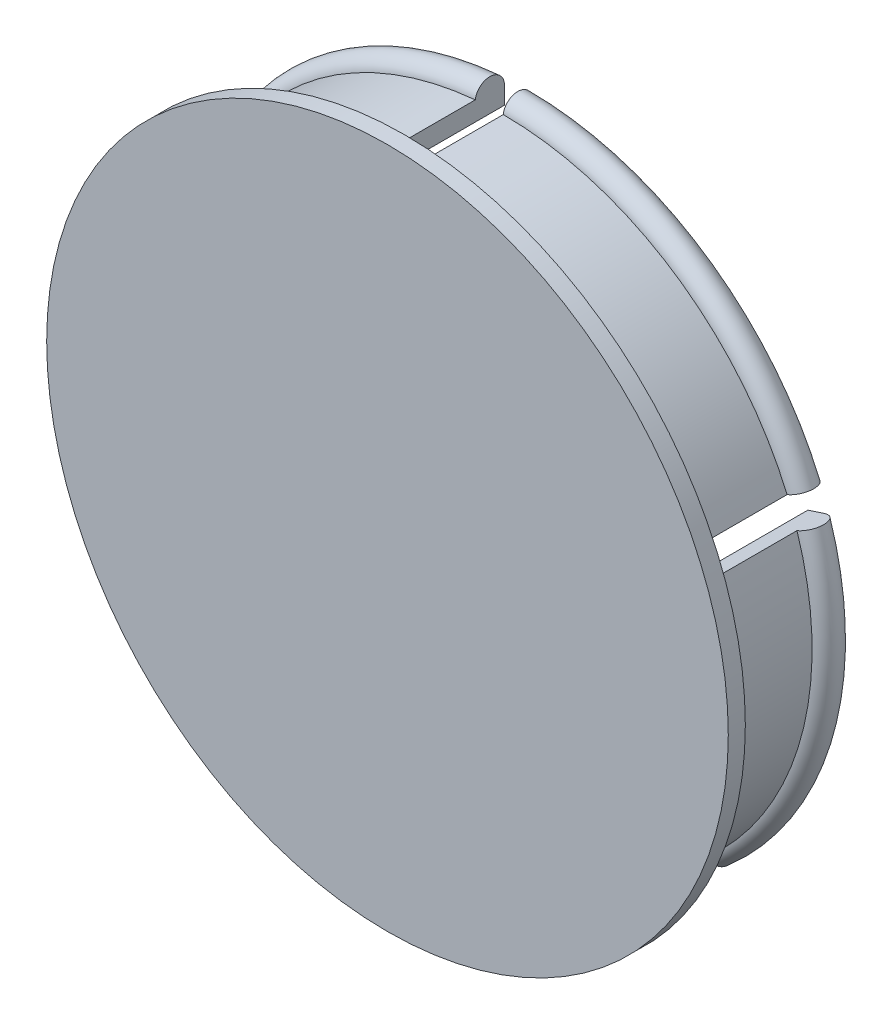
from build123d import *

# Parameters (mm, degrees)
ESQUISSE1_R                  = 40
BOSS_EXTRU_1_DEPTH           = 2
ESQUISSE2_R                  = 36.25
ESQUISSE2_R_2                = 34
BOSS_EXTRU_2_DEPTH           = 15
ENL_V_MAT_EXTRU_4_DEPTH      = 25
R_P_TITION_CIRCULAIRE1_COUNT = 5


with BuildPart() as part:
    # Esquisse1 → Boss.-Extru.1 (new body)
    with BuildSketch(Plane.XY):
        Circle(ESQUISSE1_R)
    boss_extru_1 = extrude(amount=BOSS_EXTRU_1_DEPTH)

    # Esquisse2 → Boss.-Extru.2 (add)
    with BuildSketch(Plane(origin=(0, 0, 0), x_dir=(-1, 0, 0), z_dir=(0, 0, -1))):
        with Locations(Location((0, 0, 0), (0, 0, 180))):
            Circle(ESQUISSE2_R)
        Circle(ESQUISSE2_R_2, mode=Mode.SUBTRACT)
    extrude(amount=BOSS_EXTRU_2_DEPTH)

    # Balayage1: sweep along a curve in space
    with BuildLine() as balayage1_path:
        ThreePointArc((-36.25, 0, -15), (-25.632620818, 25.632620818, -15), (0, 36.25, -15))
        ThreePointArc((0, 36.25, -15), (25.632620818, 25.632620818, -15), (36.25, 0, -15))
        ThreePointArc((36.25, 0, -15), (25.632620818, -25.632620818, -15), (0, -36.25, -15))
        ThreePointArc((0, -36.25, -15), (-25.632620818, -25.632620818, -15), (-36.25, 0, -15))
    # Esquisse3 → Balayage1 (sweep)
    with BuildSketch(Plane(origin=(0, 0, 0), x_dir=(0, 0, -1), z_dir=(1, 0, 0))):
        with BuildLine():
            Line((15, -36.25), (11.586582868, -36.25))
            ThreePointArc((11.586582868, -36.25), (13.293291434, -37.75), (15, -36.25))
        make_face()
    sweep(path=balayage1_path.line)

    # Esquisse6 → Enlèv. mat.-Extru.4 (cut)
    with BuildSketch(Plane(origin=(0, 0, 0), x_dir=(-1, 0, 0), z_dir=(0, 0, -1))):
        Polygon((0, 34), (0, 93.818938969), (3.286152277, 93.649691617), (3.286152277, 33.840821551), align=None)
    enl_v_mat_extru_4 = extrude(amount=ENL_V_MAT_EXTRU_4_DEPTH, mode=Mode.SUBTRACT)

    # Répétition circulaire1: Boss.-Extru.1, Enlèv. mat.-Extru.4 ×5 about axis
    r_p_tition_circulaire1_axis = Axis((0, 0, 0), (0, 0, 1))
    add([boss_extru_1.rotate(r_p_tition_circulaire1_axis, i * 360 / R_P_TITION_CIRCULAIRE1_COUNT) for i in range(1, R_P_TITION_CIRCULAIRE1_COUNT)])
    add([enl_v_mat_extru_4.rotate(r_p_tition_circulaire1_axis, i * 360 / R_P_TITION_CIRCULAIRE1_COUNT) for i in range(1, R_P_TITION_CIRCULAIRE1_COUNT)], mode=Mode.SUBTRACT)


solid = part.part
